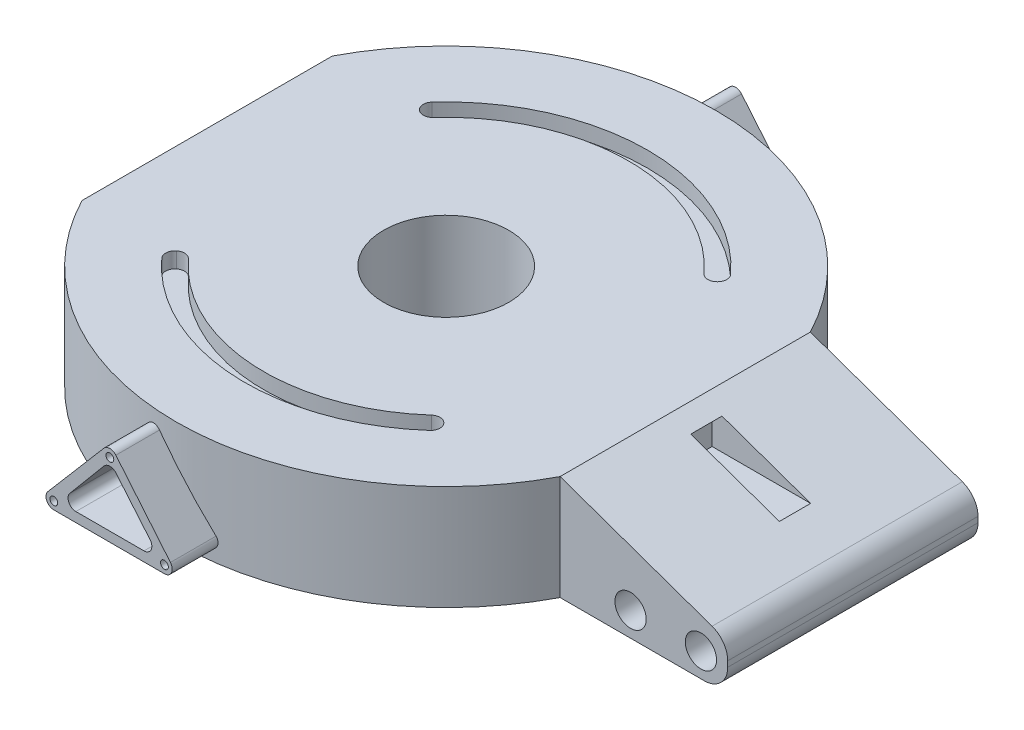
from build123d import *

# Parameters (mm, degrees)
SKETCH1_R                = 40
BOSS_EXTRUDE1_DEPTH      = 67
CUT_EXTRUDE1_DEPTH       = 10
BOSS_EXTRUDE2_DEPTH      = 80
CUT_EXTRUDE2_REACH       = 370.572
SKETCH4_R                = 10
FILLET1_R                = 15
CUT_EXTRUDE5_REACH       = 365.464
SKETCH6_W                = 20
SKETCH6_H                = 20
BOSS_EXTRUDE3_REACH      = 461.179
BOSS_EXTRUDE3_END_RADIUS = 172.5
SKETCH8_R                = 2.5
CUT_EXTRUDE6_DEPTH       = 40


with BuildPart() as part:
    # Sketch1 → Boss-Extrude1 (new body)
    with BuildSketch(Plane(origin=(0, 0, 0), x_dir=(1, 0, 0), z_dir=(0, 1, 0))):
        with BuildLine():
            Line((-152.827517156, 80), (-152.827517156, -80))
            ThreePointArc((-152.827517156, -80), (0, -172.5), (152.827517156, -80))
            Line((152.827517156, -80), (152.827517156, 80))
            ThreePointArc((152.827517156, 80), (0, 172.5), (-152.827517156, 80))
        make_face()
        with Locations(Location((0, 0, 0), (0, 0, 270))):
            Circle(SKETCH1_R, mode=Mode.SUBTRACT)
    extrude(amount=BOSS_EXTRUDE1_DEPTH)

    # Sketch2 → Cut-Extrude1 (cut)
    with BuildSketch(Plane(origin=(0, 67, 0), x_dir=(1, 0, 0), z_dir=(0, 1, 0))):
        with BuildLine():
            Line((-94.805792729, 77.709483627), (-94.766560633, 77.677326247))
            ThreePointArc((-94.766560633, 77.677326247), (-90.5175234, 76.33424343), (-86.514217379, 78.291723895))
            ThreePointArc((-86.514217379, 78.291723895), (0, 116.680348985), (86.514217379, 78.291723895))
            ThreePointArc((86.514217379, 78.291723895), (90.5175234, 76.33424343), (94.766560633, 77.677326247))
            Line((94.766560633, 77.677326247), (94.805792729, 77.709483627))
            ThreePointArc((94.805792729, 77.709483627), (96.985665668, 81.904305313), (95.451092594, 86.375710069))
            ThreePointArc((95.451092594, 86.375710069), (0, 128.731015561), (-95.451092594, 86.375710069))
            ThreePointArc((-95.451092594, 86.375710069), (-96.985665668, 81.904305313), (-94.805792729, 77.709483627))
        make_face()
        with BuildLine():
            Line((-94.805792729, -77.709483627), (-94.766560633, -77.677326247))
            ThreePointArc((-94.766560633, -77.677326247), (-90.5175234, -76.33424343), (-86.514217379, -78.291723895))
            ThreePointArc((-86.514217379, -78.291723895), (-6.261835306, -116.512202184), (77.624689613, -87.11321026))
            ThreePointArc((77.624689613, -87.11321026), (81.814735563, -85.59607355), (85.895347897, -87.386825304))
            Line((85.895347897, -87.386825304), (85.930907429, -87.423002288))
            ThreePointArc((85.930907429, -87.423002288), (87.648629228, -91.827296423), (85.643657226, -96.108471762))
            ThreePointArc((85.643657226, -96.108471762), (-6.90855337, -128.545502674), (-95.451092594, -86.375710069))
            ThreePointArc((-95.451092594, -86.375710069), (-96.985665668, -81.904305313), (-94.805792729, -77.709483627))
        make_face()
    extrude(amount=-CUT_EXTRUDE1_DEPTH, mode=Mode.SUBTRACT)

    # Sketch3 → Boss-Extrude2 (add, symmetric)
    with BuildSketch(Plane.XY):
        Polygon((152.827517156, 67), (260, 29.182962561), (260, 0), (152.827517156, 0), align=None)
    extrude(amount=BOSS_EXTRUDE2_DEPTH, both=True)

    # Sketch4 → Cut-Extrude2 (cut, up to next)
    with BuildSketch(Plane.XY.offset(80), mode=Mode.PRIVATE) as cut_extrude2_sk1:
        with Locations((197.867868221, 15.46479665)):
            Circle(SKETCH4_R)
    cut_extrude2_tool1 = extrude(cut_extrude2_sk1.sketch, amount=-CUT_EXTRUDE2_REACH, mode=Mode.PRIVATE) & part.part
    # Sketch4 → Cut-Extrude2 (cut, up to next)
    with BuildSketch(Plane.XY.offset(80), mode=Mode.PRIVATE) as cut_extrude2_sk2:
        with Locations((242.867868221, 15.46479665)):
            Circle(SKETCH4_R)
    cut_extrude2_tool2 = extrude(cut_extrude2_sk2.sketch, amount=-CUT_EXTRUDE2_REACH, mode=Mode.PRIVATE) & part.part
    add(cut_extrude2_tool1.solids().sort_by_distance((197.867868, 15.464797, 80))[0], mode=Mode.SUBTRACT)
    add(cut_extrude2_tool2.solids().sort_by_distance((242.867868, 15.464797, 80))[0], mode=Mode.SUBTRACT)

    # Fillet1
    fillet1_edges = [part.edges().sort_by_distance(p)[0] for p in [
        (260, 0, 0),
        (260, 29.182962561, 0),
    ]]
    fillet(fillet1_edges, radius=FILLET1_R)

    # Cut-Extrude5: up to this plane
    cut_extrude5_end = Plane(origin=(152.827517156, 67, 80), z_dir=(-0.3327532596919791, -0.9430139278740067, 0))
    # Sketch6 → Cut-Extrude5 (cut, up to the surface)
    with BuildSketch(Plane(origin=(160, 0, 0), x_dir=(0, 0, -1), z_dir=(1, 0, 0)), mode=Mode.PRIVATE) as cut_extrude5_sk1:
        with Locations((0, 52.234802616)):
            Rectangle(SKETCH6_W, SKETCH6_H)
    cut_extrude5_tool1 = split(extrude(cut_extrude5_sk1.sketch, amount=CUT_EXTRUDE5_REACH, mode=Mode.PRIVATE), bisect_by=cut_extrude5_end, keep=Keep.BOTH, mode=Mode.PRIVATE)
    add(cut_extrude5_tool1.solids().sort_by_distance((160, 52.234803, 0))[0], mode=Mode.SUBTRACT)

    # Boss-Extrude3: up to this cylinder (the profile starts outside it)
    boss_extrude3_end = Plane(origin=(0, 35.241624, 0), z_dir=(0, -1, 0)) * Cylinder(BOSS_EXTRUDE3_END_RADIUS, 1268.358, mode=Mode.PRIVATE)
    # Sketch7 → Boss-Extrude3 (add, up to the surface)
    with BuildSketch(Plane.XY.offset(200), mode=Mode.PRIVATE) as boss_extrude3_sk1:
        with BuildLine():
            Line((-18.820406998, 56.872330571), (-54.64630767, 14.938742986))
            ThreePointArc((-54.64630767, 14.938742986), (-55.385658765, 9.597966882), (-50.844780808, 6.690913939))
            Line((-50.844780808, 6.690913939), (19.866759041, 6.690913939))
            ThreePointArc((19.866759041, 6.690913939), (24.393824394, 9.568255396), (23.71052462, 14.888642223))
            Line((23.71052462, 14.888642223), (-11.175114557, 56.822229808))
            ThreePointArc((-11.175114557, 56.822229808), (-14.986115079, 58.624394168), (-18.820406998, 56.872330571))
        make_face()
        with BuildLine():
            Line((-18.798269892, 47.008349057), (-40.57573529, 21.054976432))
            ThreePointArc((-40.57573529, 21.054976432), (-41.277052009, 15.727947075), (-36.745513074, 12.841038384))
            Line((-36.745513074, 12.841038384), (6.809417721, 12.841038384))
            ThreePointArc((6.809417721, 12.841038384), (11.340956656, 15.727947075), (10.639639936, 21.054976432))
            Line((10.639639936, 21.054976432), (-11.137825461, 47.008349057))
            ThreePointArc((-11.137825461, 47.008349057), (-14.968047677, 48.794411009), (-18.798269892, 47.008349057))
        make_face(mode=Mode.SUBTRACT)
    boss_extrude3_tool1 = extrude(boss_extrude3_sk1.sketch, amount=-BOSS_EXTRUDE3_REACH, mode=Mode.PRIVATE) - boss_extrude3_end
    boss_extrude3 = boss_extrude3_tool1.solids().sort_by_distance((5.529884, 35.241624, 200))[0]
    add(boss_extrude3)

    # Sketch8 → Cut-Extrude6 (cut)
    with BuildSketch(Plane.XY.offset(200)):
        with Locations((-15.018880135, 53.624501524)):
            Circle(SKETCH8_R)
        with Locations((19.866759041, 11.690913939)):
            Circle(SKETCH8_R)
        with Locations((-50.844780808, 11.690913939)):
            Circle(SKETCH8_R)
    cut_extrude6 = extrude(amount=-CUT_EXTRUDE6_DEPTH, mode=Mode.SUBTRACT)

    # Mirror1: Boss-Extrude3, Cut-Extrude6 across plane
    add(boss_extrude3.mirror(Plane.XY))
    add(cut_extrude6.mirror(Plane.XY), mode=Mode.SUBTRACT)


solid = part.part
